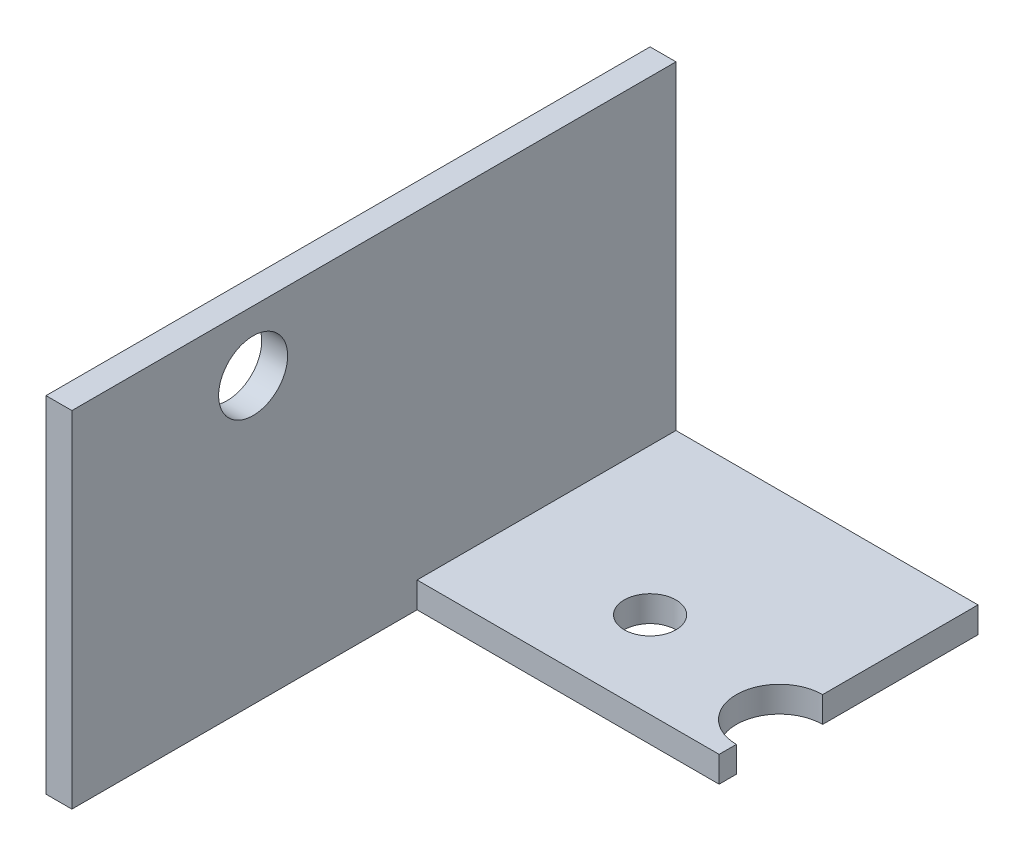
from build123d import *

# Parameters (mm, degrees)
EXTRUSION1_DEPTH = 35
ESQUISSE2_R      = 2
EXTRUSION2_DEPTH = 17
ESQUISSE4_R      = 1.5
ESQUISSE4_R_2    = 2.5
ESQUISSE4_W      = 17.5
ESQUISSE4_H      = 20
EXTRUSION3_DEPTH = 17


with BuildPart() as part:
    # Esquisse1 → Extrusion1 (new body)
    with BuildSketch(Plane.XY):
        Polygon((-13.454581117, 9.773157895), (-13.454581117, -10.226842105), (5.545418883, -10.226842105), (5.545418883, -8.726842105), (-11.954581117, -8.726842105), (-11.954581117, 9.773157895), align=None)
    extrude(amount=EXTRUSION1_DEPTH)

    # Esquisse2 → Extrusion2 (cut)
    with BuildSketch(Plane(origin=(-11.954581117, 0, 0), x_dir=(0, 0, -1), z_dir=(1, 0, 0))):
        with Locations(Location((-24.5, 6.273157895, 0), (0, 0, 90))):
            Circle(ESQUISSE2_R)
    extrude(amount=-EXTRUSION2_DEPTH, mode=Mode.SUBTRACT)

    # Esquisse4 → Extrusion3 (cut)
    with BuildSketch(Plane(origin=(0, -8.726842105, 0), x_dir=(-1, 0, 0), z_dir=(0, 1, 0))):
        with Locations((3.454581117, 10)):
            Circle(ESQUISSE4_R)
        with Locations((-5.545418883, 11.5)):
            Circle(ESQUISSE4_R_2)
        with Locations((3.204581117, 25)):
            Rectangle(ESQUISSE4_W, ESQUISSE4_H)
    extrude(amount=-EXTRUSION3_DEPTH, mode=Mode.SUBTRACT)


solid = part.part
